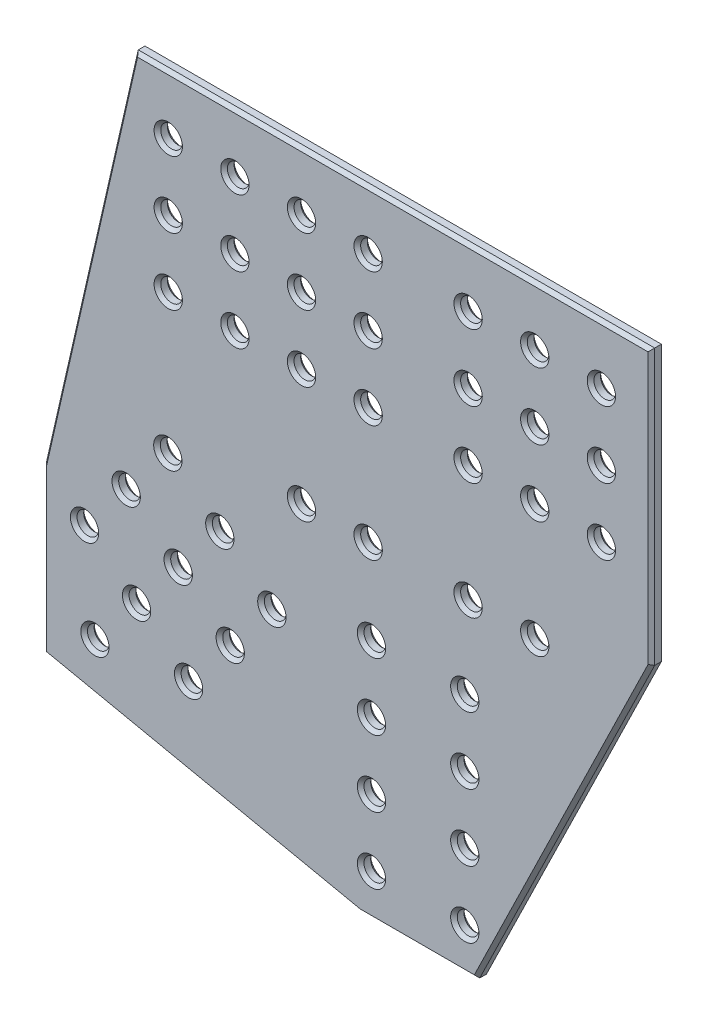
from build123d import *

# Parameters (mm, degrees)
SKETCH_1_R         = 13
EXTRUDE_1536_DEPTH = 16
CHAMFER_2_SIZE     = 4


with BuildPart() as part:
    # 草图1 → Extrude 1536 (new body)
    with BuildSketch(Plane.XY):
        Polygon((730, -330), (520, -760), (380, -760), (0, -680), (0, -482.786642105), (110, 0), (730, 0), align=None)
        with Locations((510, -70)):
            Circle(SKETCH_1_R, mode=Mode.SUBTRACT)
        with Locations((590, -70)):
            Circle(SKETCH_1_R, mode=Mode.SUBTRACT)
        with Locations((670, -70)):
            Circle(SKETCH_1_R, mode=Mode.SUBTRACT)
        with Locations((510, -150)):
            Circle(SKETCH_1_R, mode=Mode.SUBTRACT)
        with Locations((590, -150)):
            Circle(SKETCH_1_R, mode=Mode.SUBTRACT)
        with Locations((670, -150)):
            Circle(SKETCH_1_R, mode=Mode.SUBTRACT)
        with Locations((510, -230)):
            Circle(SKETCH_1_R, mode=Mode.SUBTRACT)
        with Locations((590, -230)):
            Circle(SKETCH_1_R, mode=Mode.SUBTRACT)
        with Locations((670, -230)):
            Circle(SKETCH_1_R, mode=Mode.SUBTRACT)
        with Locations(Location((230, -230, 0), (0, 0, 180))):
            Circle(SKETCH_1_R, mode=Mode.SUBTRACT)
        with Locations(Location((310, -230, 0), (0, 0, 180))):
            Circle(SKETCH_1_R, mode=Mode.SUBTRACT)
        with Locations(Location((390, -230, 0), (0, 0, 180))):
            Circle(SKETCH_1_R, mode=Mode.SUBTRACT)
        with Locations(Location((230, -150, 0), (0, 0, 180))):
            Circle(SKETCH_1_R, mode=Mode.SUBTRACT)
        with Locations(Location((310, -150, 0), (0, 0, 180))):
            Circle(SKETCH_1_R, mode=Mode.SUBTRACT)
        with Locations(Location((390, -150, 0), (0, 0, 180))):
            Circle(SKETCH_1_R, mode=Mode.SUBTRACT)
        with Locations(Location((230, -70, 0), (0, 0, 180))):
            Circle(SKETCH_1_R, mode=Mode.SUBTRACT)
        with Locations(Location((310, -70, 0), (0, 0, 180))):
            Circle(SKETCH_1_R, mode=Mode.SUBTRACT)
        with Locations(Location((390, -70, 0), (0, 0, 180))):
            Circle(SKETCH_1_R, mode=Mode.SUBTRACT)
        with Locations((150, -70)):
            Circle(SKETCH_1_R, mode=Mode.SUBTRACT)
        with Locations((150, -150)):
            Circle(SKETCH_1_R, mode=Mode.SUBTRACT)
        with Locations((150, -230)):
            Circle(SKETCH_1_R, mode=Mode.SUBTRACT)
        with Locations((590, -370)):
            Circle(SKETCH_1_R, mode=Mode.SUBTRACT)
        with Locations((510, -370)):
            Circle(SKETCH_1_R, mode=Mode.SUBTRACT)
        with Locations(Location((390, -370, 0), (0, 0, 180))):
            Circle(SKETCH_1_R, mode=Mode.SUBTRACT)
        with Locations(Location((310, -370, 0), (0, 0, 180))):
            Circle(SKETCH_1_R, mode=Mode.SUBTRACT)
        with Locations((506, -470)):
            Circle(SKETCH_1_R, mode=Mode.SUBTRACT)
        with Locations((506, -550)):
            Circle(SKETCH_1_R, mode=Mode.SUBTRACT)
        with Locations((506, -630)):
            Circle(SKETCH_1_R, mode=Mode.SUBTRACT)
        with Locations((506, -710)):
            Circle(SKETCH_1_R, mode=Mode.SUBTRACT)
        with Locations(Location((394, -710, 0), (0, 0, 180))):
            Circle(SKETCH_1_R, mode=Mode.SUBTRACT)
        with Locations(Location((394, -630, 0), (0, 0, 180))):
            Circle(SKETCH_1_R, mode=Mode.SUBTRACT)
        with Locations(Location((394, -550, 0), (0, 0, 180))):
            Circle(SKETCH_1_R, mode=Mode.SUBTRACT)
        with Locations(Location((394, -470, 0), (0, 0, 180))):
            Circle(SKETCH_1_R, mode=Mode.SUBTRACT)
        with Locations((149.479377198, -397.484050539)):
            Circle(SKETCH_1_R, mode=Mode.SUBTRACT)
        with Locations((99.493096694, -459.945012437)):
            Circle(SKETCH_1_R, mode=Mode.SUBTRACT)
        with Locations((49.506816189, -522.405974336)):
            Circle(SKETCH_1_R, mode=Mode.SUBTRACT)
        with Locations((61.981497584, -634.85321674)):
            Circle(SKETCH_1_R, mode=Mode.SUBTRACT)
        with Locations((111.967778088, -572.392254841)):
            Circle(SKETCH_1_R, mode=Mode.SUBTRACT)
        with Locations((161.954058593, -509.931292942)):
            Circle(SKETCH_1_R, mode=Mode.SUBTRACT)
        with Locations((211.940339097, -447.470331043)):
            Circle(SKETCH_1_R, mode=Mode.SUBTRACT)
        with Locations(Location((174.428739987, -622.378535345, 0), (0, 0, 180))):
            Circle(SKETCH_1_R, mode=Mode.SUBTRACT)
        with Locations(Location((224.415020492, -559.917573446, 0), (0, 0, 180))):
            Circle(SKETCH_1_R, mode=Mode.SUBTRACT)
        with Locations(Location((274.401300996, -497.456611548, 0), (0, 0, 180))):
            Circle(SKETCH_1_R, mode=Mode.SUBTRACT)
    extrude(amount=EXTRUDE_1536_DEPTH)

    # 倒角2
    chamfer_2_edges = [part.edges().sort_by_distance(p)[0] for p in [
        (55, -241.393321053, 16),
        (497, -370, 0),
        (497, -370, 16),
        (403, -370, 0),
        (403, -370, 16),
        (323, -370, 0),
        (323, -370, 16),
        (493, -470, 0),
        (493, -470, 16),
        (493, -550, 0),
        (493, -550, 16),
        (493, -630, 0),
        (493, -630, 16),
        (493, -710, 0),
        (493, -710, 16),
        (407, -710, 0),
        (407, -710, 16),
        (0, -581.393321053, 16),
        (407, -630, 0),
        (407, -630, 16),
        (407, -550, 0),
        (407, -550, 16),
        (136.479377198, -397.484050539, 0),
        (136.479377198, -397.484050539, 16),
        (86.493096694, -459.945012437, 0),
        (86.493096694, -459.945012437, 16),
        (36.506816189, -522.405974336, 0),
        (36.506816189, -522.405974336, 16),
        (48.981497584, -634.85321674, 0),
        (48.981497584, -634.85321674, 16),
        (98.967778088, -572.392254841, 0),
        (98.967778088, -572.392254841, 16),
        (148.954058593, -509.931292942, 0),
        (148.954058593, -509.931292942, 16),
        (190, -720, 16),
        (198.940339097, -447.470331043, 0),
        (198.940339097, -447.470331043, 16),
        (187.428739987, -622.378535345, 0),
        (187.428739987, -622.378535345, 16),
        (237.415020492, -559.917573446, 0),
        (237.415020492, -559.917573446, 16),
        (287.401300996, -497.456611548, 0),
        (287.401300996, -497.456611548, 16),
        (407, -470, 0),
        (407, -470, 16),
        (497, -70, 0),
        (497, -70, 16),
        (450, -760, 16),
        (625, -545, 16),
        (577, -70, 0),
        (577, -70, 16),
        (657, -70, 0),
        (657, -70, 16),
        (497, -150, 0),
        (497, -150, 16),
        (577, -150, 0),
        (577, -150, 16),
        (657, -150, 0),
        (657, -150, 16),
        (730, -165, 16),
        (497, -230, 0),
        (497, -230, 16),
        (577, -230, 0),
        (577, -230, 16),
        (657, -230, 0),
        (657, -230, 16),
        (243, -230, 0),
        (243, -230, 16),
        (323, -230, 0),
        (323, -230, 16),
        (403, -230, 0),
        (403, -230, 16),
        (243, -150, 0),
        (243, -150, 16),
        (323, -150, 0),
        (323, -150, 16),
        (625, -545, 0),
        (420, 0, 16),
        (403, -150, 0),
        (403, -150, 16),
        (450, -760, 0),
        (243, -70, 0),
        (243, -70, 16),
        (190, -720, 0),
        (323, -70, 0),
        (323, -70, 16),
        (0, -581.393321053, 0),
        (403, -70, 0),
        (403, -70, 16),
        (55, -241.393321053, 0),
        (137, -70, 0),
        (137, -70, 16),
        (420, 0, 0),
        (137, -150, 0),
        (137, -150, 16),
        (730, -165, 0),
        (137, -230, 0),
        (137, -230, 16),
        (577, -370, 0),
        (577, -370, 16),
    ]]
    chamfer(chamfer_2_edges, length=CHAMFER_2_SIZE)


solid = part.part
